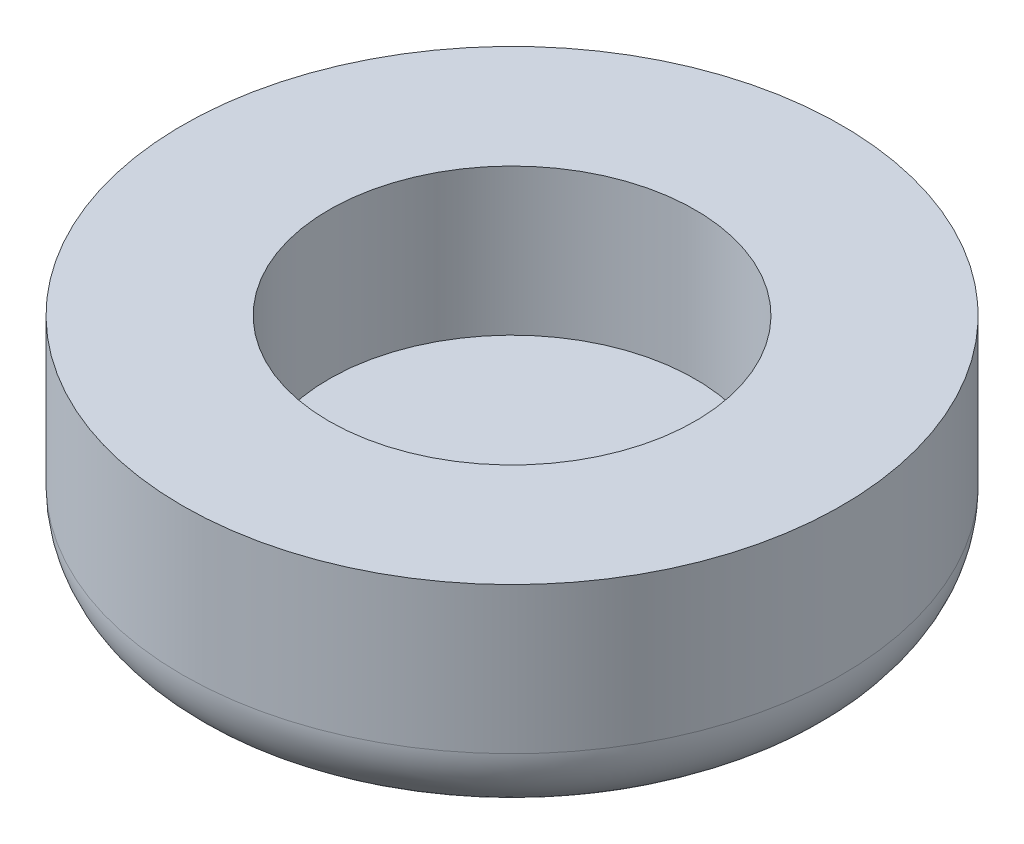
from build123d import *

# Parameters (mm, degrees)
SKETCH1_R           = 4.5
BOSS_EXTRUDE1_DEPTH = 3
SKETCH2_R           = 2.5
CUT_EXTRUDE1_DEPTH  = 2
FILLET1_R           = 1


with BuildPart() as part:
    # Sketch1 → Boss-Extrude1 (new body)
    with BuildSketch(Plane(origin=(0, 0, 0), x_dir=(1, 0, 0), z_dir=(0, 1, 0))):
        with Locations(Location((0, 0, 0), (0, 0, 270))):
            Circle(SKETCH1_R)
    extrude(amount=BOSS_EXTRUDE1_DEPTH)

    # Sketch2 → Cut-Extrude1 (cut)
    with BuildSketch(Plane(origin=(0, 3, 0), x_dir=(1, 0, 0), z_dir=(0, 1, 0))):
        with Locations(Location((0, 0, 0), (0, 0, 270))):
            Circle(SKETCH2_R)
    extrude(amount=-CUT_EXTRUDE1_DEPTH, mode=Mode.SUBTRACT)

    # Fillet1
    fillet1_edges = [part.edges().sort_by_distance(p)[0] for p in [
        (0, 0, -4.5),
    ]]
    fillet(fillet1_edges, radius=FILLET1_R)


solid = part.part
